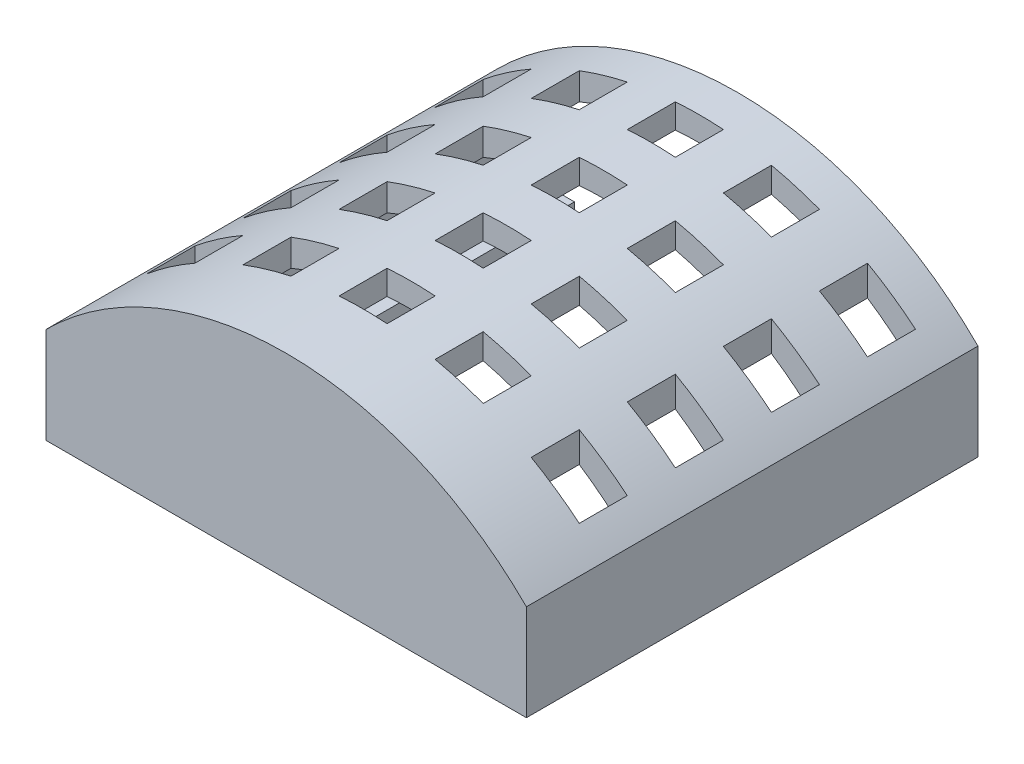
from build123d import *

# Parameters (mm, degrees)
EXTRUDE_1_DEPTH     = 45
EXTRUDE_2_DEPTH     = 2
SKETCH_5_W          = 5
SKETCH_5_H          = 5
CUT_EXTRUDE_1_DEPTH = 46


with BuildPart() as part:
    # Эскиз1 → Бобышка-Вытянуть1 (new body)
    with BuildSketch(Plane.XY):
        with BuildLine():
            Line((0, 0), (0, 6))
            ThreePointArc((0, 6), (25, 16.355339059), (50, 6))
            Line((50, 6), (50, 0))
            Line((50, 0), (50, -4))
            Line((50, -4), (42, -4))
            Line((42, -4), (42, -2))
            Line((42, -2), (47.5, -2))
            Line((47.5, -2), (47.5, 0))
            Line((47.5, 0), (47.5, 4.5))
            ThreePointArc((47.5, 4.5), (25, 13.819805153), (2.5, 4.5))
            Line((2.5, 4.5), (2.5, 0))
            Line((2.5, 0), (2.5, -2))
            Line((2.5, -2), (8, -2))
            Line((8, -2), (8, -4))
            Line((8, -4), (0, -4))
            Line((0, -4), (0, 0))
        make_face()
    extrude(amount=EXTRUDE_1_DEPTH)

    # Эскиз3 → Бобышка-Вытянуть2 (add)
    with BuildSketch(Plane.XY.offset(45)):
        with BuildLine():
            Line((0, -4), (50, -4))
            Line((50, -4), (50, 6))
            ThreePointArc((50, 6), (25, 16.355339059), (0, 6))
            Line((0, 6), (0, -4))
        make_face()
    extrude(amount=EXTRUDE_2_DEPTH)

    # Эскиз5 → Вырез-Вытянуть1 (cut)
    with BuildSketch(Plane(origin=(0, 4, 0), x_dir=(1, 0, 0), z_dir=(0, 1, 0))):
        with Locations((15, -6.5)):
            Rectangle(SKETCH_5_W, SKETCH_5_H)
        with Locations((5, -6.5)):
            Rectangle(SKETCH_5_W, SKETCH_5_H)
        with Locations((25, -6.5)):
            Rectangle(SKETCH_5_W, SKETCH_5_H)
        with Locations((35, -6.5)):
            Rectangle(SKETCH_5_W, SKETCH_5_H)
        with Locations((45, -6.5)):
            Rectangle(SKETCH_5_W, SKETCH_5_H)
        with Locations((15, -16.5)):
            Rectangle(SKETCH_5_W, SKETCH_5_H)
        with Locations((5, -16.5)):
            Rectangle(SKETCH_5_W, SKETCH_5_H)
        with Locations((25, -16.5)):
            Rectangle(SKETCH_5_W, SKETCH_5_H)
        with Locations((35, -16.5)):
            Rectangle(SKETCH_5_W, SKETCH_5_H)
        with Locations((45, -16.5)):
            Rectangle(SKETCH_5_W, SKETCH_5_H)
        with Locations((15, -26.5)):
            Rectangle(SKETCH_5_W, SKETCH_5_H)
        with Locations((5, -26.5)):
            Rectangle(SKETCH_5_W, SKETCH_5_H)
        with Locations((25, -26.5)):
            Rectangle(SKETCH_5_W, SKETCH_5_H)
        with Locations((35, -26.5)):
            Rectangle(SKETCH_5_W, SKETCH_5_H)
        with Locations((45, -26.5)):
            Rectangle(SKETCH_5_W, SKETCH_5_H)
        with Locations((15, -36.5)):
            Rectangle(SKETCH_5_W, SKETCH_5_H)
        with Locations((5, -36.5)):
            Rectangle(SKETCH_5_W, SKETCH_5_H)
        with Locations((25, -36.5)):
            Rectangle(SKETCH_5_W, SKETCH_5_H)
        with Locations((35, -36.5)):
            Rectangle(SKETCH_5_W, SKETCH_5_H)
        with Locations((45, -36.5)):
            Rectangle(SKETCH_5_W, SKETCH_5_H)
    extrude(amount=CUT_EXTRUDE_1_DEPTH, mode=Mode.SUBTRACT)


solid = part.part
